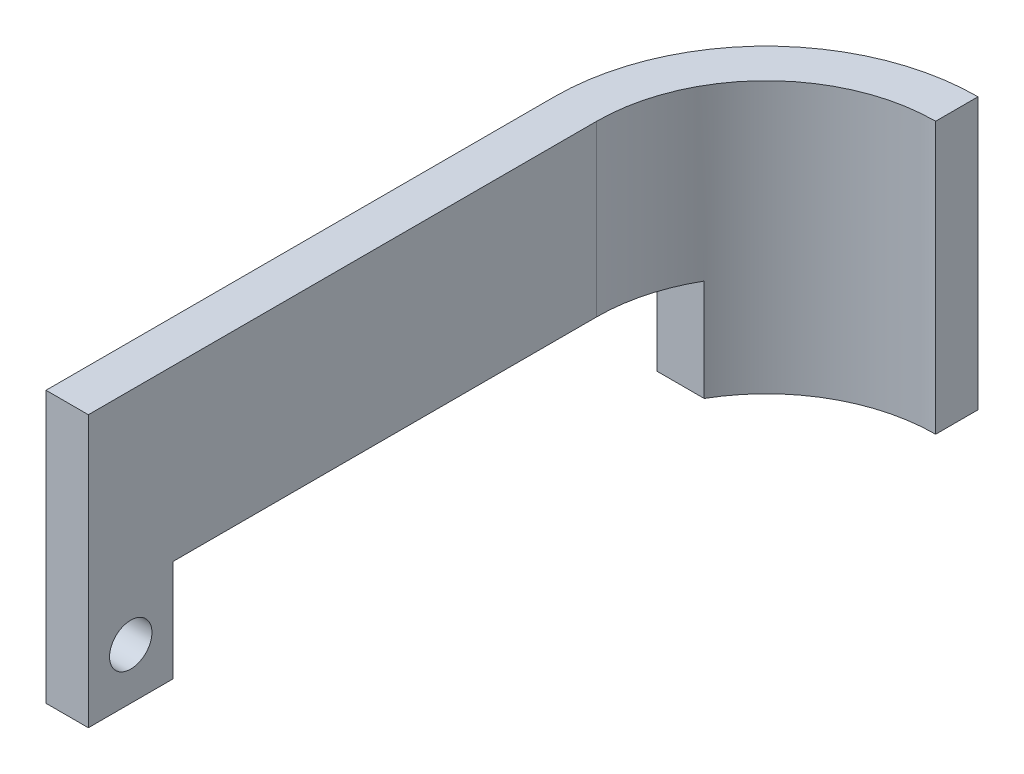
from build123d import *

# Parameters (mm, degrees)
BOSS_EXTRUDE1_DEPTH = 40.64
SKETCH2_R           = 3.175
CUT_EXTRUDE1_DEPTH  = 40.64
SKETCH3_W           = 76.2
SKETCH3_H           = 15.24
CUT_EXTRUDE2_DEPTH  = 40.64


with BuildPart() as part:
    # Sketch1 → Boss-Extrude1 (new body)
    with BuildSketch(Plane(origin=(0, 0, 0), x_dir=(1, 0, 0), z_dir=(0, 1, 0))):
        with BuildLine():
            Line((31.75, 101.6), (31.75, 107.95))
            ThreePointArc((31.75, 107.95), (9.299359697, 98.650640303), (0, 76.2))
            Line((0, 76.2), (0, 0))
            Line((0, 0), (6.35, 0))
            Line((6.35, 0), (6.35, 76.2))
            ThreePointArc((6.35, 76.2), (13.789487758, 94.160512242), (31.75, 101.6))
        make_face()
    extrude(amount=BOSS_EXTRUDE1_DEPTH)

    # Sketch2 → Cut-Extrude1 (cut)
    with BuildSketch(Plane(origin=(6.35, 0, 0), x_dir=(0, 0, -1), z_dir=(1, 0, 0))):
        with Locations((6.35, 7.62)):
            Circle(SKETCH2_R)
    extrude(amount=-CUT_EXTRUDE1_DEPTH, mode=Mode.SUBTRACT)

    # Sketch3 → Cut-Extrude2 (cut)
    with BuildSketch(Plane(origin=(0, 0, 0), x_dir=(0, 0, -1), z_dir=(1, 0, 0))):
        with Locations((50.8, 7.62)):
            Rectangle(SKETCH3_W, SKETCH3_H)
    extrude(amount=CUT_EXTRUDE2_DEPTH, mode=Mode.SUBTRACT)


solid = part.part
